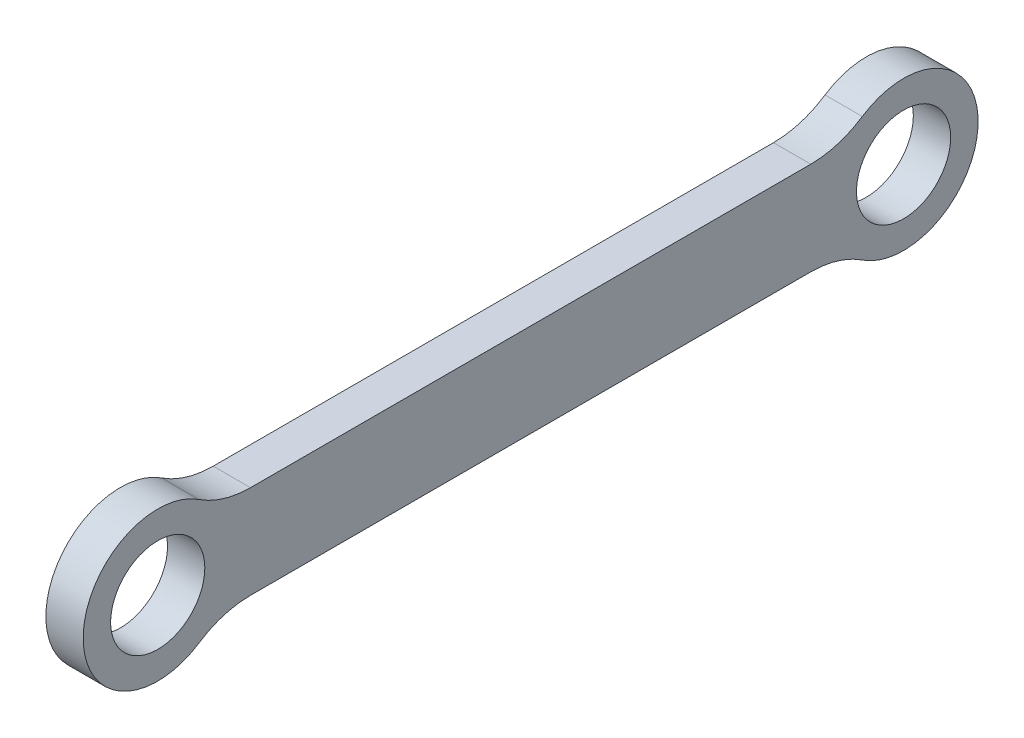
from build123d import *

# Parameters (mm, degrees)
BOSS_EXTRU_1_DEPTH      = 4
ESQUISSE2_R             = 5.05
ENL_V_MAT_EXTRU_1_DEPTH = 10
CONG_1_R                = 10


with BuildPart() as part:
    # Esquisse1 → Boss.-Extru.1 (new body)
    with BuildSketch(Plane(origin=(0, 0, 0), x_dir=(0, 0, -1), z_dir=(1, 0, 0))):
        with BuildLine():
            ThreePointArc((33.755002002, 5), (48, 0), (33.755002002, -5))
            Line((33.755002002, -5), (-33.755002002, -5))
            ThreePointArc((-33.755002002, -5), (-48, 0), (-33.755002002, 5))
            Line((-33.755002002, 5), (33.755002002, 5))
        make_face()
    extrude(amount=BOSS_EXTRU_1_DEPTH)

    # Esquisse2 → Enlèv. mat.-Extru.1 (cut)
    with BuildSketch(Plane(origin=(4, 0, 0), x_dir=(0, 0, -1), z_dir=(1, 0, 0))):
        with Locations((-40, 0)):
            Circle(ESQUISSE2_R)
        with Locations((40, 0)):
            Circle(ESQUISSE2_R)
    extrude(amount=-ENL_V_MAT_EXTRU_1_DEPTH, mode=Mode.SUBTRACT)

    # Congé1
    cong_1_edges = [part.edges().sort_by_distance(p)[0] for p in [
        (2, -5, 33.755002002),
        (2, 5, 33.755002002),
        (2, 5, -33.755002002),
        (2, -5, -33.755002002),
    ]]
    fillet(cong_1_edges, radius=CONG_1_R)


solid = part.part
